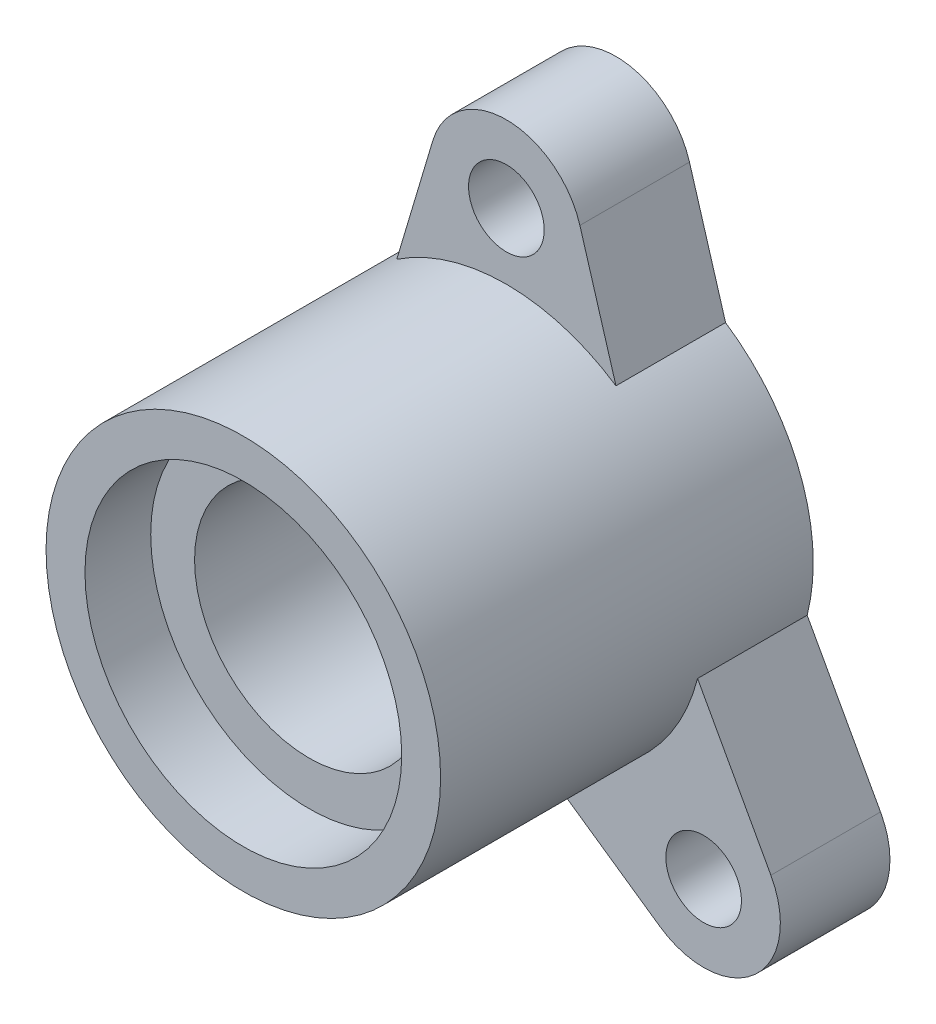
from build123d import *

# Parameters (mm, degrees)
SKETCH1_R           = 5.225
SKETCH1_R_2         = 1.725
BOSS_EXTRUDE1_DEPTH = 5
SKETCH2_R           = 9
SKETCH2_R_2         = 5.225
BOSS_EXTRUDE2_DEPTH = 12
CUT_EXTRUDE1_START  = -3
SKETCH3_R           = 7.225
SKETCH3_R_2         = 5.225
CUT_EXTRUDE1_DEPTH  = 3


with BuildPart() as part:
    # Sketch1 → Boss-Extrude1 (new body)
    with BuildSketch(Plane.XY):
        with BuildLine():
            Line((8.72254439, -2.217480408), (12.068556171, -8.316562141))
            ThreePointArc((12.068556171, -8.316562141), (11.341376561, -12.601529512), (7.003749271, -12.87488835))
            Line((7.003749271, -12.87488835), (1.289602928, -8.907127724))
            ThreePointArc((1.289602928, -8.907127724), (0, -9), (-1.289602928, -8.907127724))
            Line((-1.289602928, -8.907127724), (-7.003749271, -12.87488835))
            ThreePointArc((-7.003749271, -12.87488835), (-11.341376561, -12.601529512), (-12.068556171, -8.316562141))
            Line((-12.068556171, -8.316562141), (-8.72254439, -2.217480408))
            ThreePointArc((-8.72254439, -2.217480408), (-8.402583705, 3.224373905), (-5, 7.483314774))
            Line((-5, 7.483314774), (-3.353912105, 13.000636594))
            ThreePointArc((-3.353912105, 13.000636594), (0, 15.5), (3.353912105, 13.000636594))
            Line((3.353912105, 13.000636594), (5, 7.483314774))
            ThreePointArc((5, 7.483314774), (8.402583705, 3.224373905), (8.72254439, -2.217480408))
        make_face()
        Circle(SKETCH1_R, mode=Mode.SUBTRACT)
        with Locations((9, -10)):
            Circle(SKETCH1_R_2, mode=Mode.SUBTRACT)
        with Locations((-9, -10)):
            Circle(SKETCH1_R_2, mode=Mode.SUBTRACT)
        with Locations((0, 12)):
            Circle(SKETCH1_R_2, mode=Mode.SUBTRACT)
    extrude(amount=BOSS_EXTRUDE1_DEPTH)

    # Sketch2 → Boss-Extrude2 (add)
    with BuildSketch(Plane.XY.offset(5)):
        Circle(SKETCH2_R)
        Circle(SKETCH2_R_2, mode=Mode.SUBTRACT)
    extrude(amount=BOSS_EXTRUDE2_DEPTH)

    # Sketch3 → Cut-Extrude1 (cut)
    with BuildSketch(Plane.XY.offset(17).offset(CUT_EXTRUDE1_START)):
        Circle(SKETCH3_R)
        Circle(SKETCH3_R_2, mode=Mode.SUBTRACT)
    extrude(amount=CUT_EXTRUDE1_DEPTH, mode=Mode.SUBTRACT)


solid = part.part
